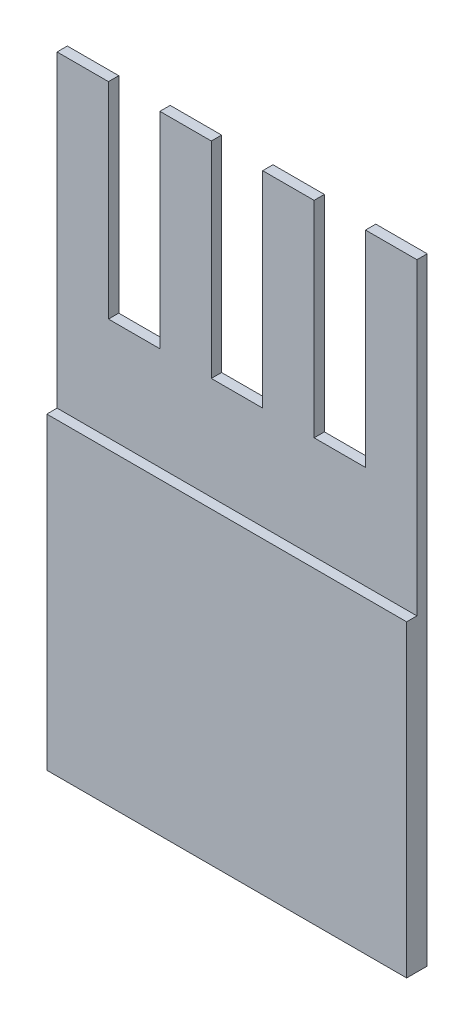
from build123d import *

# Parameters (mm, degrees)
SKETCH1_W           = 35
SKETCH1_H           = 30
BOSS_EXTRUDE5_DEPTH = 2
BOSS_EXTRUDE6_DEPTH = 1


with BuildPart() as part:
    # Sketch1 → Boss-Extrude5 (new body)
    with BuildSketch(Plane.XY):
        with Locations((0, -15)):
            Rectangle(SKETCH1_W, SKETCH1_H)
    extrude(amount=BOSS_EXTRUDE5_DEPTH)

    # Sketch1<7> → Boss-Extrude6 (add)
    with BuildSketch(Plane.XY):
        Polygon((-12.5, 10), (-12.5, 30), (-17.5, 30), (-17.5, 10), (-17.5, 0), (17.5, 0), (17.5, 10), (17.5, 30), (12.5, 30), (12.5, 10), (7.5, 10), (7.5, 30), (2.5, 30), (2.5, 10), (-2.5, 10), (-2.5, 30), (-7.5, 30), (-7.5, 10), align=None)
    extrude(amount=BOSS_EXTRUDE6_DEPTH)


solid = part.part
